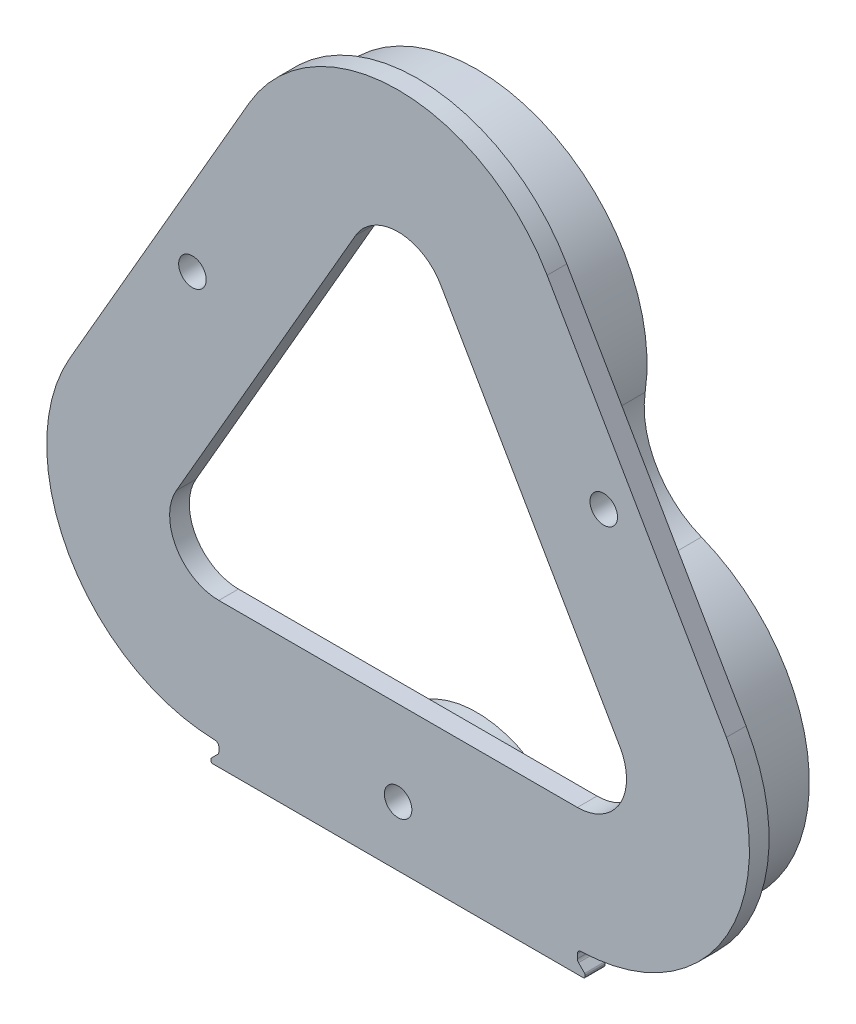
from build123d import *

# Parameters (mm, degrees)
SKETCH1_R           = 1.4
BOSS_EXTRUDE1_DEPTH = 2
BOSS_EXTRUDE2_DEPTH = 6


with BuildPart() as part:
    # Sketch1 → Boss-Extrude1 (new body)
    with BuildSketch(Plane.XY):
        with BuildLine():
            Line((78.466333699, 24.25), (60.234282891, 55.828838325))
            ThreePointArc((60.234282891, 55.828838325), (45.078838325, 64.578838325), (29.923393759, 55.828838325))
            Line((29.923393759, 55.828838325), (11.691342951, 24.25))
            ThreePointArc((11.691342951, 24.25), (11.594517635, 6.919891409), (26.455726065, -1.995630053))
            ThreePointArc((26.455726065, -1.995630053), (26.732773023, -2.115865565), (26.846787517, -2.395530168))
            Line((26.846787517, -2.395530168), (26.846787517, -2.834314575))
            ThreePointArc((26.846787517, -2.834314575), (26.81633933, -2.987387948), (26.72963023, -3.117157288))
            Line((26.72963023, -3.117157288), (26.105366161, -3.741421356))
            ThreePointArc((26.105366161, -3.741421356), (26.062011611, -3.806306026), (26.046787517, -3.882842712))
            Line((26.046787517, -3.882842712), (26.046787517, -4))
            ThreePointArc((26.046787517, -4), (26.105366161, -4.141421356), (26.246787517, -4.2))
            Line((26.246787517, -4.2), (63.910889132, -4.2))
            ThreePointArc((63.910889132, -4.2), (64.052310489, -4.141421356), (64.110889132, -4))
            Line((64.110889132, -4), (64.110889132, -3.882842712))
            ThreePointArc((64.110889132, -3.882842712), (64.095665039, -3.806306026), (64.052310489, -3.741421356))
            Line((64.052310489, -3.741421356), (63.42804642, -3.117157288))
            ThreePointArc((63.42804642, -3.117157288), (63.341337319, -2.987387948), (63.310889132, -2.834314575))
            Line((63.310889132, -2.834314575), (63.310889132, -2.395530168))
            ThreePointArc((63.310889132, -2.395530168), (63.424903627, -2.115865565), (63.701950585, -1.995630053))
            ThreePointArc((63.701950585, -1.995630053), (78.563159015, 6.919891409), (78.466333699, 24.25))
        make_face()
        with Locations((65.994459855, 38.101919162)):
            Circle(SKETCH1_R, mode=Mode.SUBTRACT)
        with Locations((45.078838325, 1.875)):
            Circle(SKETCH1_R, mode=Mode.SUBTRACT)
        with Locations((24.163216795, 38.101919162)):
            Circle(SKETCH1_R, mode=Mode.SUBTRACT)
        with BuildLine():
            Line((26.846787517, 10.5), (63.310889132, 10.5))
            ThreePointArc((63.310889132, 10.5), (67.641016151, 13), (67.641016151, 18))
            Line((67.641016151, 18), (49.408965344, 49.578838325))
            ThreePointArc((49.408965344, 49.578838325), (45.078838325, 52.078838325), (40.748711306, 49.578838325))
            Line((40.748711306, 49.578838325), (22.516660498, 18))
            ThreePointArc((22.516660498, 18), (22.516660498, 13), (26.846787517, 10.5))
        make_face(mode=Mode.SUBTRACT)
    extrude(amount=BOSS_EXTRUDE1_DEPTH)

    # Sketch2 → Boss-Extrude2 (add)
    with BuildSketch(Plane(origin=(0, 0, 0), x_dir=(-1, 0, 0), z_dir=(0, 0, -1))):
        with BuildLine():
            ThreePointArc((-27.949498848, 42.516002182), (-45.078838325, 62.398838325), (-62.208177802, 42.516002182))
            ThreePointArc((-62.208177802, 42.516002182), (-63.337010114, 36.567639839), (-67.924026858, 32.615861208))
            ThreePointArc((-67.924026858, 32.615861208), (-76.578398318, 7.84), (-50.794687381, 2.946974934))
            ThreePointArc((-50.794687381, 2.946974934), (-45.078838325, 4.943558647), (-39.362989268, 2.946974934))
            ThreePointArc((-39.362989268, 2.946974934), (-13.579278331, 7.84), (-22.233649792, 32.615861208))
            ThreePointArc((-22.233649792, 32.615861208), (-26.820666536, 36.567639839), (-27.949498848, 42.516002182))
        make_face()
        with BuildLine():
            ThreePointArc((-67.623619549, 31.852870089), (-62.626869283, 36.157639839), (-61.397204455, 42.637337381))
            ThreePointArc((-61.397204455, 42.637337381), (-45.078838325, 61.578838325), (-28.760472195, 42.637337381))
            ThreePointArc((-28.760472195, 42.637337381), (-27.530807367, 36.157639839), (-22.534057101, 31.852870089))
            ThreePointArc((-22.534057101, 31.852870089), (-14.289419162, 8.25), (-38.852423231, 3.588630855))
            ThreePointArc((-38.852423231, 3.588630855), (-45.078838325, 5.763558647), (-51.305253419, 3.588630855))
            ThreePointArc((-51.305253419, 3.588630855), (-75.868257487, 8.25), (-67.623619549, 31.852870089))
        make_face(mode=Mode.SUBTRACT)
    extrude(amount=BOSS_EXTRUDE2_DEPTH)


solid = part.part
